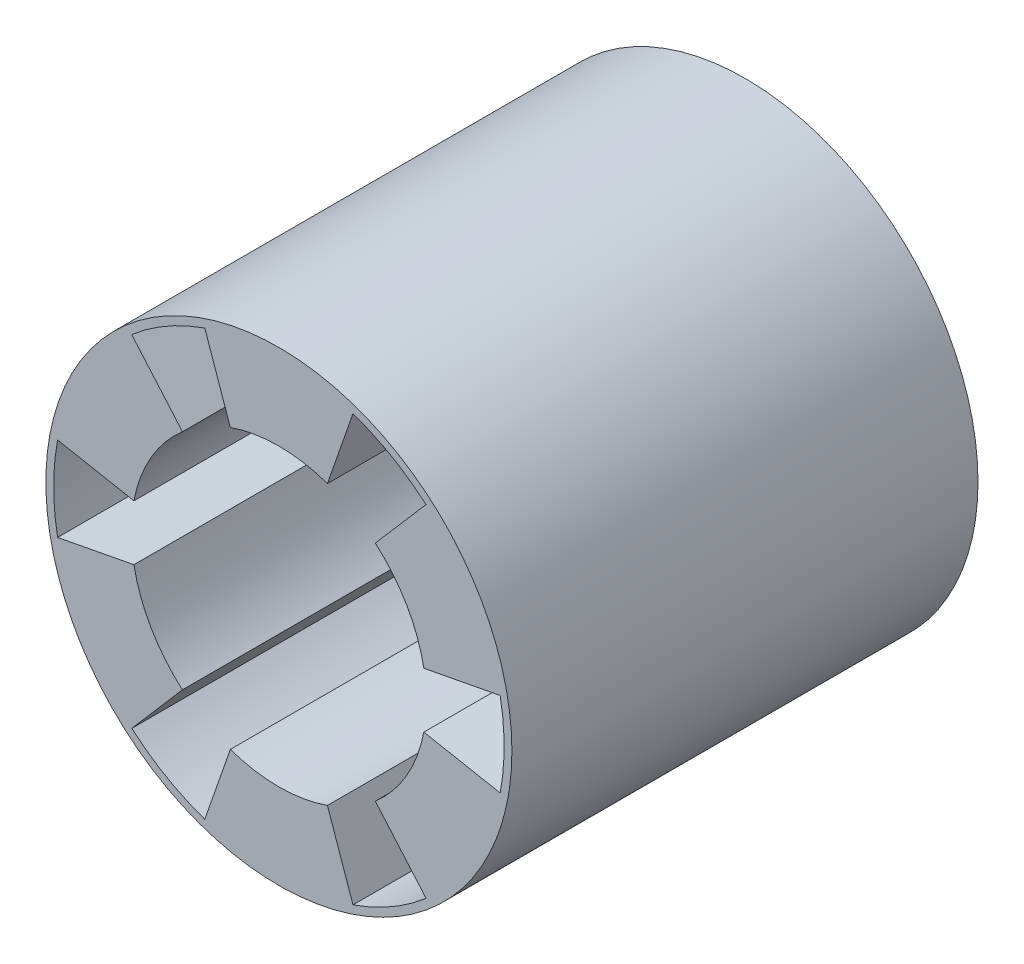
from build123d import *

# Parameters (mm, degrees)
SKETCH4_R           = 30
BOSS_EXTRUDE2_DEPTH = 60
CUT_EXTRUDE1_DEPTH  = 74.484692283


with BuildPart() as part:
    # Sketch4 → Boss-Extrude2 (new body)
    with BuildSketch(Plane.XY):
        Circle(SKETCH4_R)
    extrude(amount=BOSS_EXTRUDE2_DEPTH)

    # Sketch5 → Cut-Extrude1 (cut, through all)
    with BuildSketch(Plane(origin=(0, 0, 0), x_dir=(-1, 0, 0), z_dir=(0, 0, -1))):
        with BuildLine():
            Line((-6.249262611, 17.942873706), (-9.538348196, 27.386491445))
            ThreePointArc((-9.538348196, 27.386491445), (-14.5, 25.11473671), (-18.948223214, 21.953697571))
            Line((-18.948223214, 21.953697571), (-12.41435314, 14.383457029))
            ThreePointArc((-12.41435314, 14.383457029), (-16.454482672, 9.5), (-18.663615752, 3.559416677))
            Line((-18.663615752, 3.559416677), (-28.48657141, 5.432793875))
            ThreePointArc((-28.48657141, 5.432793875), (-29, 0), (-28.48657141, -5.432793875))
            Line((-28.48657141, -5.432793875), (-18.663615752, -3.559416677))
            ThreePointArc((-18.663615752, -3.559416677), (-16.454482672, -9.5), (-12.41435314, -14.383457029))
            Line((-12.41435314, -14.383457029), (-18.948223214, -21.953697571))
            ThreePointArc((-18.948223214, -21.953697571), (-14.5, -25.11473671), (-9.538348196, -27.386491445))
            Line((-9.538348196, -27.386491445), (-6.249262611, -17.942873706))
            ThreePointArc((-6.249262611, -17.942873706), (0, -19), (6.249262611, -17.942873706))
            Line((6.249262611, -17.942873706), (9.538348196, -27.386491445))
            ThreePointArc((9.538348196, -27.386491445), (14.5, -25.11473671), (18.948223214, -21.953697571))
            Line((18.948223214, -21.953697571), (12.41435314, -14.383457029))
            ThreePointArc((12.41435314, -14.383457029), (16.454482672, -9.5), (18.663615752, -3.559416677))
            Line((18.663615752, -3.559416677), (28.48657141, -5.432793875))
            ThreePointArc((28.48657141, -5.432793875), (29, 0), (28.48657141, 5.432793875))
            Line((28.48657141, 5.432793875), (18.663615752, 3.559416677))
            ThreePointArc((18.663615752, 3.559416677), (16.454482672, 9.5), (12.41435314, 14.383457029))
            Line((12.41435314, 14.383457029), (18.948223214, 21.953697571))
            ThreePointArc((18.948223214, 21.953697571), (14.5, 25.11473671), (9.538348196, 27.386491445))
            Line((9.538348196, 27.386491445), (6.249262611, 17.942873706))
            ThreePointArc((6.249262611, 17.942873706), (0, 19), (-6.249262611, 17.942873706))
        make_face()
    extrude(amount=-CUT_EXTRUDE1_DEPTH, mode=Mode.SUBTRACT)


solid = part.part
